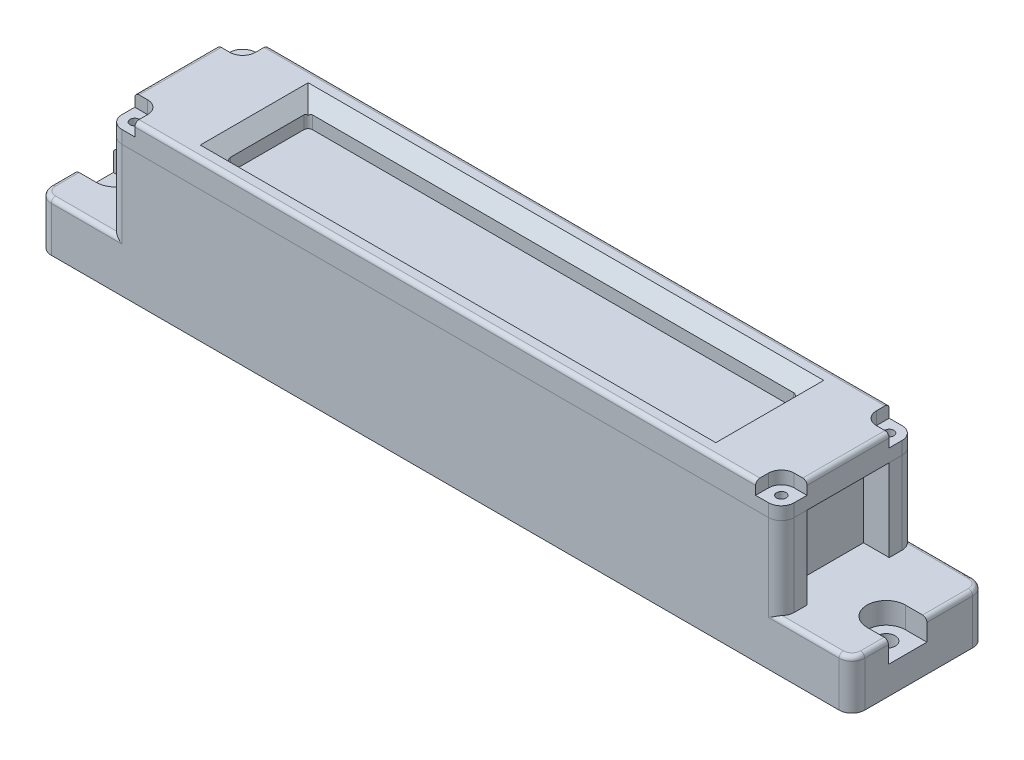
from build123d import *

# Parameters (mm, degrees)
SKETCH_1_W          = 144.4
SKETCH_1_H          = 23.2
EXTRUDE_393_DEPTH   = 11.6
SKETCH_2_W          = 190
SKETCH_2_H          = 31.2
SKETCH_2_R          = 2.1
EXTRUDE_2_DEPTH     = 6.5
EXTRUDE_3_DEPTH     = 5
EXTRUDE_4_DEPTH     = 19.2
SKETCH_5_R          = 1.1
CUT_EXTRUDE_1_DEPTH = 102.048750611
CUT_EXTRUDE_2_DEPTH = 100.26731587
SKETCH_6_W          = 157
SKETCH_6_H          = 31.2
SKETCH_6_R          = 1.1
SKETCH_6_W_2        = 114.4
SKETCH_6_H_2        = 19.2
EXTRUDE_6_DEPTH     = 3
SKETCH_7_W          = 114.4
SKETCH_7_H          = 19.2
EXTRUDE_7_DEPTH     = 3
CHAMFER_1_SIZE      = 3
FILLET_1_R          = 3
FILLET_2_R          = 3
FILLET_3_R          = 1
FILLET_4_R          = 1


with BuildPart() as part:
    # ｽｹｯﾁ1 → Extrude 393 (new, symmetric)
    with BuildSketch(Plane(origin=(0, 0, 0), x_dir=(1, 0, 0), z_dir=(0, 1, 0))):
        Rectangle(SKETCH_1_W, SKETCH_1_H)
    extrude(amount=EXTRUDE_393_DEPTH, both=True)


with BuildPart() as body_2:
    # ｽｹｯﾁ2 → ﾎﾞｽ - 押し出し2 (new body)
    with BuildSketch(Plane.XZ.offset(11.6)):
        Rectangle(SKETCH_2_W, SKETCH_2_H)
        with Locations(Location((-90, 2.6, 0), (0, 0, 90))):
            Circle(SKETCH_2_R, mode=Mode.SUBTRACT)
        with Locations(Location((90, 2.6, 0), (0, 0, 90))):
            Circle(SKETCH_2_R, mode=Mode.SUBTRACT)
    extrude(amount=EXTRUDE_2_DEPTH)

    # ｽｹｯﾁ3 → ﾎﾞｽ - 押し出し3 (add)
    with BuildSketch(Plane(origin=(0, -11.6, 0), x_dir=(1, 0, 0), z_dir=(0, 1, 0))):
        with BuildLine():
            Line((-95, 1.9), (-90, 1.9))
            ThreePointArc((-90, 1.9), (-85.5, -2.6), (-90, -7.1))
            Line((-90, -7.1), (-95, -7.1))
            Line((-95, -7.1), (-95, -15.6))
            Line((-95, -15.6), (0, -15.6))
            Line((0, -15.6), (0, -11.9))
            Line((0, -11.9), (-72.5, -11.9))
            Line((-72.5, -11.9), (-72.5, 11.9))
            Line((-72.5, 11.9), (0, 11.9))
            Line((0, 11.9), (0, 15.6))
            Line((0, 15.6), (-95, 15.6))
            Line((-95, 15.6), (-95, 1.9))
        make_face()
        with BuildLine():
            Line((95, 15.6), (0, 15.6))
            Line((0, 15.6), (0, 11.9))
            Line((0, 11.9), (72.5, 11.9))
            Line((72.5, 11.9), (72.5, -11.9))
            Line((72.5, -11.9), (0, -11.9))
            Line((0, -11.9), (0, -15.6))
            Line((0, -15.6), (95, -15.6))
            Line((95, -15.6), (95, -7.1))
            Line((95, -7.1), (90, -7.1))
            ThreePointArc((90, -7.1), (85.5, -2.6), (90, 1.9))
            Line((90, 1.9), (95, 1.9))
            Line((95, 1.9), (95, 15.6))
        make_face()
    extrude(amount=EXTRUDE_3_DEPTH)

    # ｽｹｯﾁ4 → ﾎﾞｽ - 押し出し4 (add)
    with BuildSketch(Plane(origin=(0, -6.6, 0), x_dir=(1, 0, 0), z_dir=(0, 1, 0))):
        Polygon((72.5, -9.6), (72.5, -11.9), (-72.5, -11.9), (-72.5, -9.6), (-78.5, -9.6), (-78.5, -15.6), (78.5, -15.6), (78.5, -9.6), align=None)
        Polygon((72.5, 11.9), (72.5, 9.6), (78.5, 9.6), (78.5, 15.6), (-78.5, 15.6), (-78.5, 9.6), (-72.5, 9.6), (-72.5, 11.9), align=None)
    extrude(amount=EXTRUDE_4_DEPTH)

    # ｽｹｯﾁ5 → ｶｯﾄ - 押し出し1 (cut, through all)
    with BuildSketch(Plane(origin=(0, 12.6, 0), x_dir=(1, 0, 0), z_dir=(0, 1, 0))):
        with Locations(Location((-75.5, 12.6, 0), (0, 0, 270))):
            Circle(SKETCH_5_R)
        with Locations(Location((75.5, 12.6, 0), (0, 0, 90))):
            Circle(SKETCH_5_R)
        with Locations(Location((75.5, -12.6, 0), (0, 0, 270))):
            Circle(SKETCH_5_R)
        with Locations(Location((-75.5, -12.6, 0), (0, 0, 90))):
            Circle(SKETCH_5_R)
    extrude(amount=-CUT_EXTRUDE_1_DEPTH, mode=Mode.SUBTRACT)

    # ｽｹｯﾁ8 → ｶｯﾄ - 押し出し2 (cut, through all)
    with BuildSketch(Plane(origin=(0, -11.6, 0), x_dir=(1, 0, 0), z_dir=(0, 1, 0))):
        with BuildLine():
            Line((-57.5, 6.9), (57.5, 6.9))
            ThreePointArc((57.5, 6.9), (61.035533906, 5.435533906), (62.5, 1.9))
            Line((62.5, 1.9), (62.5, -1.9))
            ThreePointArc((62.5, -1.9), (61.035533906, -5.435533906), (57.5, -6.9))
            Line((57.5, -6.9), (-57.5, -6.9))
            ThreePointArc((-57.5, -6.9), (-61.035533906, -5.435533906), (-62.5, -1.9))
            Line((-62.5, -1.9), (-62.5, 1.9))
            ThreePointArc((-62.5, 1.9), (-61.035533906, 5.435533906), (-57.5, 6.9))
        make_face()
    extrude(amount=-CUT_EXTRUDE_2_DEPTH, mode=Mode.SUBTRACT)

    # ﾌｨﾚｯﾄ1
    fillet_1_edges = [body_2.edges().sort_by_distance(p)[0] for p in [
        (78.5, 3, 15.6),
        (-95, -12.35, 15.6),
        (95, -12.35, 15.6),
        (-78.5, 3, 15.6),
        (95, -12.35, -15.6),
        (-95, -12.35, -15.6),
        (-78.5, 3, -15.6),
        (78.5, 3, -15.6),
    ]]
    fillet(fillet_1_edges, radius=FILLET_1_R)

    # ﾌｨﾚｯﾄ4
    fillet_4_edges = [body_2.edges().sort_by_distance(p)[0] for p in [
        (95, -6.6, 9.85),
        (83.75, -6.6, -15.6),
        (94.121320344, -6.6, 14.721320344),
        (94.121320344, -6.6, -14.721320344),
        (-83.75, -6.6, 15.6),
        (-95, -6.6, -7.25),
        (-94.121320344, -6.6, 14.721320344),
        (-94.121320344, -6.6, -14.721320344),
        (95, -6.6, -7.25),
        (-95, -6.6, 9.85),
        (83.75, -6.6, 15.6),
        (-83.75, -6.6, -15.6),
    ]]
    fillet(fillet_4_edges, radius=FILLET_4_R)


with BuildPart() as body_3:
    # ｽｹｯﾁ6 → ﾎﾞｽ - 押し出し6 (new body)
    with BuildSketch(Plane(origin=(0, 12.6, 0), x_dir=(1, 0, 0), z_dir=(0, 1, 0))):
        Rectangle(SKETCH_6_W, SKETCH_6_H)
        with Locations(Location((75.5, -12.6, 0), (0, 0, 270))):
            Circle(SKETCH_6_R, mode=Mode.SUBTRACT)
        with Locations(Location((75.5, 12.6, 0), (0, 0, 270))):
            Circle(SKETCH_6_R, mode=Mode.SUBTRACT)
        with Locations(Location((-75.5, -12.6, 0), (0, 0, 270))):
            Circle(SKETCH_6_R, mode=Mode.SUBTRACT)
        with Locations(Location((-75.5, 12.6, 0), (0, 0, 270))):
            Circle(SKETCH_6_R, mode=Mode.SUBTRACT)
        Rectangle(SKETCH_6_W_2, SKETCH_6_H_2, mode=Mode.SUBTRACT)
    extrude(amount=EXTRUDE_6_DEPTH)

    # ｽｹｯﾁ7 → ﾎﾞｽ - 押し出し7 (add)
    # profile 1 of 5: a face of its own
    with BuildSketch(Plane(origin=(0, 15.6, 0), x_dir=(1, 0, 0), z_dir=(0, 1, 0))):
        Polygon((-72.5, -12.6), (-72.5, -15.6), (72.5, -15.6), (72.5, -12.6), (72.5, -9.6), (75.5, -9.6), (78.5, -9.6), (78.5, 9.6), (75.5, 9.6), (72.5, 9.6), (72.5, 12.6), (72.5, 15.6), (-72.5, 15.6), (-72.5, 12.6), (-72.5, 9.6), (-75.5, 9.6), (-78.5, 9.6), (-78.5, -9.6), (-75.5, -9.6), (-72.5, -9.6), align=None)
        Rectangle(SKETCH_7_W, SKETCH_7_H, mode=Mode.SUBTRACT)
    # profile 2 of 5: a face of its own
    with BuildSketch(Plane(origin=(0, 15.6, 0), x_dir=(1, 0, 0), z_dir=(0, 1, 0))):
        with BuildLine():
            ThreePointArc((-72.5, 12.6), (-73.378679656, 10.478679656), (-75.5, 9.6))
            Line((-75.5, 9.6), (-72.5, 9.6))
            Line((-72.5, 9.6), (-72.5, 12.6))
        make_face()
    # profile 3 of 5: a face of its own
    with BuildSketch(Plane(origin=(0, 15.6, 0), x_dir=(1, 0, 0), z_dir=(0, 1, 0))):
        with BuildLine():
            ThreePointArc((-75.5, -9.6), (-73.378679656, -10.478679656), (-72.5, -12.6))
            Line((-72.5, -12.6), (-72.5, -9.6))
            Line((-72.5, -9.6), (-75.5, -9.6))
        make_face()
    # profile 4 of 5: a face of its own
    with BuildSketch(Plane(origin=(0, 15.6, 0), x_dir=(1, 0, 0), z_dir=(0, 1, 0))):
        with BuildLine():
            Line((72.5, 9.6), (75.5, 9.6))
            ThreePointArc((75.5, 9.6), (73.378679656, 10.478679656), (72.5, 12.6))
            Line((72.5, 12.6), (72.5, 9.6))
        make_face()
    # profile 5 of 5: a face of its own
    with BuildSketch(Plane(origin=(0, 15.6, 0), x_dir=(1, 0, 0), z_dir=(0, 1, 0))):
        with BuildLine():
            Line((72.5, -9.6), (72.5, -12.6))
            ThreePointArc((72.5, -12.6), (73.378679656, -10.478679656), (75.5, -9.6))
            Line((75.5, -9.6), (72.5, -9.6))
        make_face()
    extrude(amount=EXTRUDE_7_DEPTH)

    # 面取り1
    chamfer_1_edges = [body_3.edges().sort_by_distance(p)[0] for p in [
        (57.2, 18.6, 0),
        (0, 18.6, 9.6),
        (-57.2, 18.6, 0),
        (0, 18.6, -9.6),
    ]]
    chamfer(chamfer_1_edges, length=CHAMFER_1_SIZE)

    # ﾌｨﾚｯﾄ2
    fillet_2_edges = [body_3.edges().sort_by_distance(p)[0] for p in [
        (-78.5, 14.1, -15.6),
        (78.5, 14.1, -15.6),
        (78.5, 14.1, 15.6),
        (-78.5, 14.1, 15.6),
    ]]
    fillet(fillet_2_edges, radius=FILLET_2_R)

    # ﾌｨﾚｯﾄ3
    fillet_3_edges = [body_3.edges().sort_by_distance(p)[0] for p in [
        (-57.2, 14.1, 9.6),
        (57.2, 14.1, 9.6),
        (57.2, 14.1, -9.6),
        (-57.2, 14.1, -9.6),
        (78.5, 18.6, 0),
        (0, 18.6, -15.6),
        (-78.5, 18.6, 0),
        (0, 18.6, 15.6),
    ]]
    fillet(fillet_3_edges, radius=FILLET_3_R)


solid = Compound([part.part, body_2.part, body_3.part])
